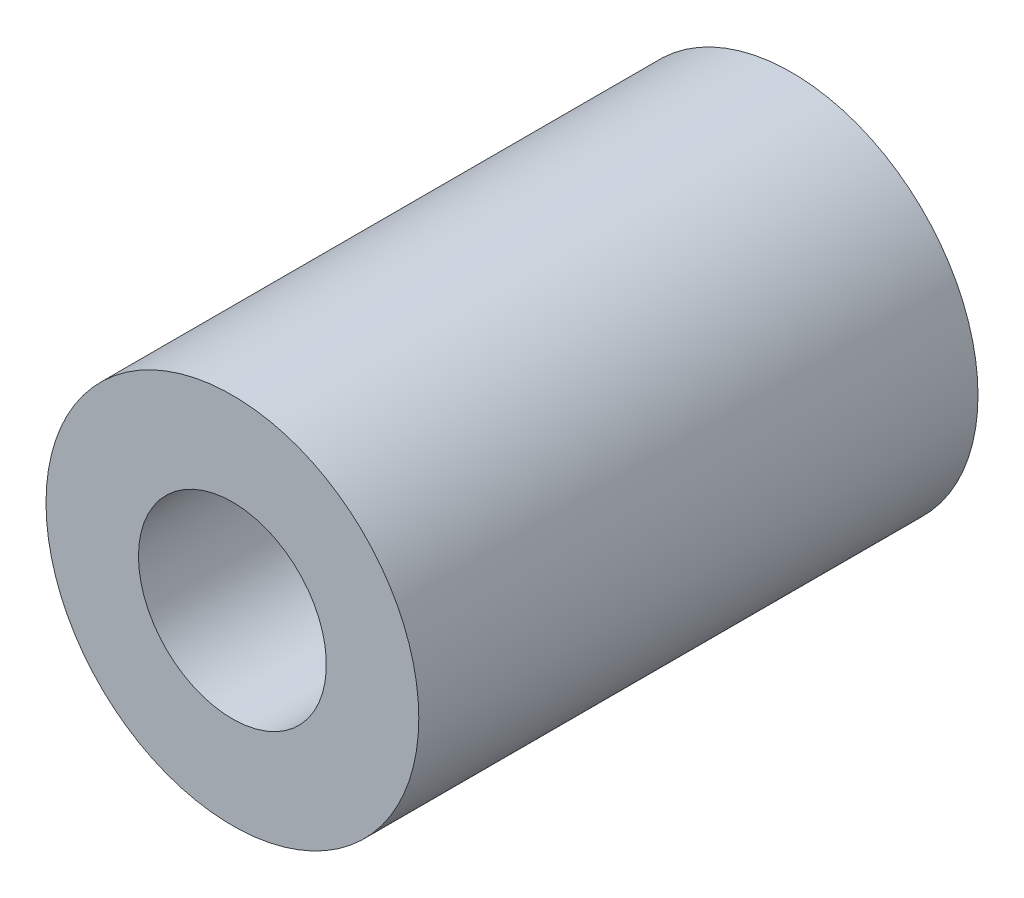
from build123d import *

# Parameters (mm, degrees)
SKETCH1_R      = 6.35
SKETCH1_R_2    = 3.2004
EXTRUDE1_DEPTH = 9.525


with BuildPart() as part:
    # Sketch1 → Extrude1 (new, symmetric)
    with BuildSketch(Plane.XY):
        with Locations(Location((0, 0, 0), (0, 0, 180))):
            Circle(SKETCH1_R)
        with Locations(Location((0, 0, 0), (0, 0, 180))):
            Circle(SKETCH1_R_2, mode=Mode.SUBTRACT)
    extrude(amount=EXTRUDE1_DEPTH, both=True)


solid = part.part
